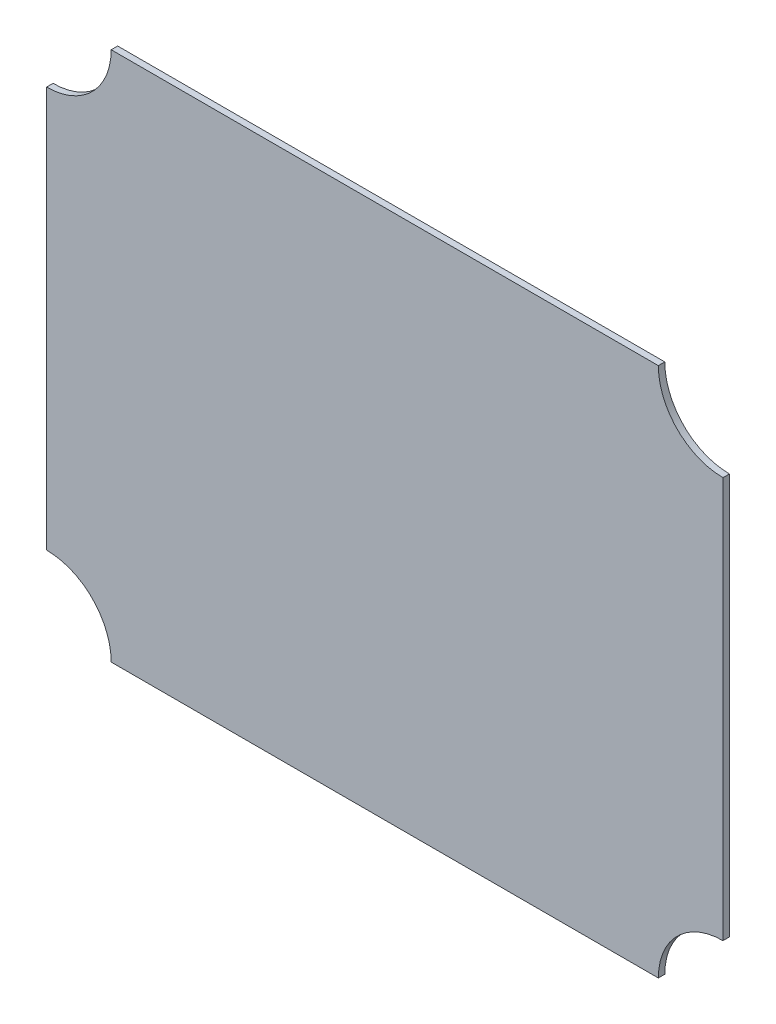
from build123d import *

# Parameters (mm, degrees)
EXTRUDE_1_DEPTH = 2.5


with BuildPart() as part:
    # 草图1 → 凸台-拉伸1 (new, symmetric)
    with BuildSketch(Plane.XY):
        with BuildLine():
            Line((-211.5, 205), (211.5, 205))
            ThreePointArc((211.5, 205), (226.144660941, 169.644660941), (261.5, 155))
            Line((261.5, 155), (261.5, -155))
            ThreePointArc((261.5, -155), (226.144660941, -169.644660941), (211.5, -205))
            Line((211.5, -205), (-211.5, -205))
            ThreePointArc((-211.5, -205), (-226.144660941, -169.644660941), (-261.5, -155))
            Line((-261.5, -155), (-261.5, 155))
            ThreePointArc((-261.5, 155), (-226.144660941, 169.644660941), (-211.5, 205))
        make_face()
    extrude(amount=EXTRUDE_1_DEPTH, both=True)


solid = part.part
